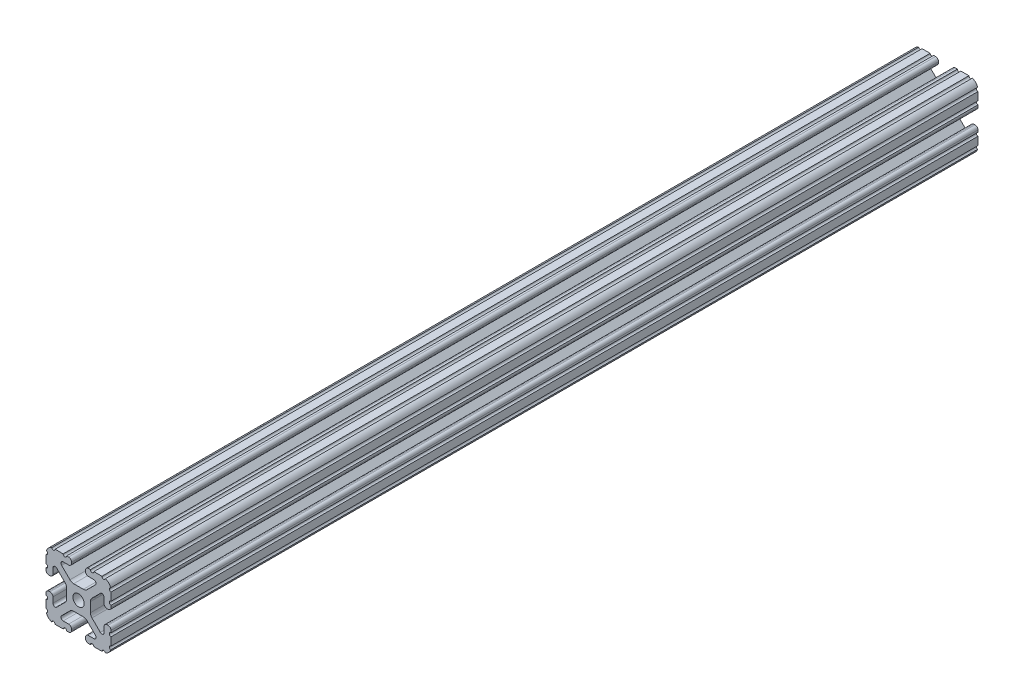
from build123d import *

# Parameters (mm, degrees)
BOSS_EXTRUDE1_DEPTH     = 304.8
CUT_EXTRUDE1_DEPTH      = 306.9883086
CUT_EXTRUDE1_DEPTH_BACK = 306.9883086
SKETCH5_R               = 1.016
CUT_EXTRUDE2_START      = -101.6
SKETCH6_R               = 3.3274
CUT_EXTRUDE2_DEPTH      = 101.6


with BuildPart() as part:
    # Sketch4 → Boss-Extrude1 (new, symmetric)
    with BuildSketch(Plane.XY):
        with BuildLine():
            Line((5.7912, -19.05), (14.3002, -19.05))
            ThreePointArc((14.3002, -19.05), (17.658815789, -17.658815789), (19.05, -14.3002))
            Line((19.05, -14.3002), (19.05, -5.7912))
            ThreePointArc((19.05, -5.7912), (18.544114832, -4.569885168), (17.3228, -4.064))
            Line((17.3228, -4.064), (16.7132, -4.064))
            ThreePointArc((16.7132, -4.064), (15.491885168, -4.569885168), (14.986, -5.7912))
            Line((14.986, -5.7912), (14.986, -8.996305235))
            ThreePointArc((14.986, -8.996305235), (14.189232738, -10.188751711), (12.782646215, -9.908964256))
            Line((12.782646215, -9.908964256), (7.888897763, -5.015215804))
            ThreePointArc((7.888897763, -5.015215804), (7.219915375, -4.014012907), (6.985, -2.833013566))
            Line((6.985, -2.833013566), (6.985, 0))
            Line((6.985, 0), (3.3274, 0))
            ThreePointArc((3.3274, 0), (2.352827104, -2.352827104), (0, -3.3274))
            Line((0, -3.3274), (0, -6.985))
            Line((0, -6.985), (2.833013566, -6.985))
            ThreePointArc((2.833013566, -6.985), (4.014012907, -7.219915375), (5.015215804, -7.888897763))
            Line((5.015215804, -7.888897763), (9.908964256, -12.782646215))
            ThreePointArc((9.908964256, -12.782646215), (10.188751711, -14.189232738), (8.996305235, -14.986))
            Line((8.996305235, -14.986), (5.7912, -14.986))
            ThreePointArc((5.7912, -14.986), (4.569885168, -15.491885168), (4.064, -16.7132))
            Line((4.064, -16.7132), (4.064, -17.3228))
            ThreePointArc((4.064, -17.3228), (4.569885168, -18.544114832), (5.7912, -19.05))
        make_face()
    extrude(amount=BOSS_EXTRUDE1_DEPTH, both=True)

    # Sketch5 → Cut-Extrude1 (cut, two sides: drawn at the far end of the back side and taken through both)
    with BuildSketch(Plane.XY.offset(-CUT_EXTRUDE1_DEPTH_BACK)):
        with Locations((14.739477062, -19.05)):
            Circle(SKETCH5_R)
        with Locations((7.980305235, -19.05)):
            Circle(SKETCH5_R)
        with Locations((19.05, -14.739477062)):
            Circle(SKETCH5_R)
        with Locations((19.05, -7.980305235)):
            Circle(SKETCH5_R)
    extrude(amount=CUT_EXTRUDE1_DEPTH + CUT_EXTRUDE1_DEPTH_BACK, mode=Mode.SUBTRACT)

    # Mirror1: part across plane


with BuildPart() as part_1:
    add(part.part)
    add(part.part.mirror(Plane(origin=(0, 0, 0), x_dir=(0, 0, 1), z_dir=(1, 0, 0))))

    # Mirror2: part across plane


with BuildPart() as part_2:
    add(part_1.part)
    add(part_1.part.mirror(Plane.ZX))

    # Sketch6 → Cut-Extrude2 (cut)
    with BuildSketch(Plane(origin=(0, 0, -304.8), x_dir=(-1, 0, 0), z_dir=(0, 0, -1)).offset(CUT_EXTRUDE2_START)):
        with BuildLine():
            Line((-19.05, -5.7912), (-19.05, -6.964305235))
            ThreePointArc((-19.05, -6.964305235), (-18.034, -7.980305235), (-19.05, -8.996305235))
            Line((-19.05, -8.996305235), (-19.05, -13.723477062))
            ThreePointArc((-19.05, -13.723477062), (-18.040083046, -14.628464695), (-18.829304583, -15.73121772))
            ThreePointArc((-18.829304583, -15.73121772), (-17.658815789, -17.658815789), (-15.73121772, -18.829304583))
            ThreePointArc((-15.73121772, -18.829304583), (-14.628464695, -18.040083046), (-13.723477062, -19.05))
            Line((-13.723477062, -19.05), (-8.996305235, -19.05))
            ThreePointArc((-8.996305235, -19.05), (-7.980305235, -18.034), (-6.964305235, -19.05))
            Line((-6.964305235, -19.05), (-5.7912, -19.05))
            ThreePointArc((-5.7912, -19.05), (-4.569885168, -18.544114832), (-4.064, -17.3228))
            Line((-4.064, -17.3228), (-4.064, -16.7132))
            ThreePointArc((-4.064, -16.7132), (-4.569885168, -15.491885168), (-5.7912, -14.986))
            Line((-5.7912, -14.986), (-8.996305235, -14.986))
            ThreePointArc((-8.996305235, -14.986), (-10.188751711, -14.189232738), (-9.908964256, -12.782646215))
            Line((-9.908964256, -12.782646215), (-5.015215804, -7.888897763))
            ThreePointArc((-5.015215804, -7.888897763), (-4.014012907, -7.219915375), (-2.833013566, -6.985))
            Line((-2.833013566, -6.985), (2.833013566, -6.985))
            ThreePointArc((2.833013566, -6.985), (4.014012907, -7.219915375), (5.015215804, -7.888897763))
            Line((5.015215804, -7.888897763), (9.908964256, -12.782646215))
            ThreePointArc((9.908964256, -12.782646215), (10.188751711, -14.189232738), (8.996305235, -14.986))
            Line((8.996305235, -14.986), (5.7912, -14.986))
            ThreePointArc((5.7912, -14.986), (4.569885168, -15.491885168), (4.064, -16.7132))
            Line((4.064, -16.7132), (4.064, -17.3228))
            ThreePointArc((4.064, -17.3228), (4.569885168, -18.544114832), (5.7912, -19.05))
            Line((5.7912, -19.05), (6.964305235, -19.05))
            ThreePointArc((6.964305235, -19.05), (7.980305235, -18.034), (8.996305235, -19.05))
            Line((8.996305235, -19.05), (13.723477062, -19.05))
            ThreePointArc((13.723477062, -19.05), (14.628464695, -18.040083046), (15.73121772, -18.829304583))
            ThreePointArc((15.73121772, -18.829304583), (17.658815789, -17.658815789), (18.829304583, -15.73121772))
            ThreePointArc((18.829304583, -15.73121772), (18.040083046, -14.628464695), (19.05, -13.723477062))
            Line((19.05, -13.723477062), (19.05, -8.996305235))
            ThreePointArc((19.05, -8.996305235), (18.034, -7.980305235), (19.05, -6.964305235))
            Line((19.05, -6.964305235), (19.05, -5.7912))
            ThreePointArc((19.05, -5.7912), (18.544114832, -4.569885168), (17.3228, -4.064))
            Line((17.3228, -4.064), (16.7132, -4.064))
            ThreePointArc((16.7132, -4.064), (15.491885168, -4.569885168), (14.986, -5.7912))
            Line((14.986, -5.7912), (14.986, -8.996305235))
            ThreePointArc((14.986, -8.996305235), (14.189232738, -10.188751711), (12.782646215, -9.908964256))
            Line((12.782646215, -9.908964256), (7.888897763, -5.015215804))
            ThreePointArc((7.888897763, -5.015215804), (7.219915375, -4.014012907), (6.985, -2.833013566))
            Line((6.985, -2.833013566), (6.985, 2.833013566))
            ThreePointArc((6.985, 2.833013566), (7.219915375, 4.014012907), (7.888897763, 5.015215804))
            Line((7.888897763, 5.015215804), (12.782646215, 9.908964256))
            ThreePointArc((12.782646215, 9.908964256), (14.189232738, 10.188751711), (14.986, 8.996305235))
            Line((14.986, 8.996305235), (14.986, 5.7912))
            ThreePointArc((14.986, 5.7912), (15.491885168, 4.569885168), (16.7132, 4.064))
            Line((16.7132, 4.064), (17.3228, 4.064))
            ThreePointArc((17.3228, 4.064), (18.544114832, 4.569885168), (19.05, 5.7912))
            Line((19.05, 5.7912), (19.05, 6.964305235))
            ThreePointArc((19.05, 6.964305235), (18.034, 7.980305235), (19.05, 8.996305235))
            Line((19.05, 8.996305235), (19.05, 13.723477062))
            ThreePointArc((19.05, 13.723477062), (18.040083046, 14.628464695), (18.829304583, 15.73121772))
            ThreePointArc((18.829304583, 15.73121772), (17.658815789, 17.658815789), (15.73121772, 18.829304583))
            ThreePointArc((15.73121772, 18.829304583), (14.628464695, 18.040083046), (13.723477062, 19.05))
            Line((13.723477062, 19.05), (8.996305235, 19.05))
            ThreePointArc((8.996305235, 19.05), (7.980305235, 18.034), (6.964305235, 19.05))
            Line((6.964305235, 19.05), (5.7912, 19.05))
            ThreePointArc((5.7912, 19.05), (4.569885168, 18.544114832), (4.064, 17.3228))
            Line((4.064, 17.3228), (4.064, 16.7132))
            ThreePointArc((4.064, 16.7132), (4.569885168, 15.491885168), (5.7912, 14.986))
            Line((5.7912, 14.986), (8.996305235, 14.986))
            ThreePointArc((8.996305235, 14.986), (10.188751711, 14.189232738), (9.908964256, 12.782646215))
            Line((9.908964256, 12.782646215), (5.015215804, 7.888897763))
            ThreePointArc((5.015215804, 7.888897763), (4.014012907, 7.219915375), (2.833013566, 6.985))
            Line((2.833013566, 6.985), (-2.833013566, 6.985))
            ThreePointArc((-2.833013566, 6.985), (-4.014012907, 7.219915375), (-5.015215804, 7.888897763))
            Line((-5.015215804, 7.888897763), (-9.908964256, 12.782646215))
            ThreePointArc((-9.908964256, 12.782646215), (-10.188751711, 14.189232738), (-8.996305235, 14.986))
            Line((-8.996305235, 14.986), (-5.7912, 14.986))
            ThreePointArc((-5.7912, 14.986), (-4.569885168, 15.491885168), (-4.064, 16.7132))
            Line((-4.064, 16.7132), (-4.064, 17.3228))
            ThreePointArc((-4.064, 17.3228), (-4.569885168, 18.544114832), (-5.7912, 19.05))
            Line((-5.7912, 19.05), (-6.964305235, 19.05))
            ThreePointArc((-6.964305235, 19.05), (-7.980305235, 18.034), (-8.996305235, 19.05))
            Line((-8.996305235, 19.05), (-13.723477062, 19.05))
            ThreePointArc((-13.723477062, 19.05), (-14.628464695, 18.040083046), (-15.73121772, 18.829304583))
            ThreePointArc((-15.73121772, 18.829304583), (-17.658815789, 17.658815789), (-18.829304583, 15.73121772))
            ThreePointArc((-18.829304583, 15.73121772), (-18.040083046, 14.628464695), (-19.05, 13.723477062))
            Line((-19.05, 13.723477062), (-19.05, 8.996305235))
            ThreePointArc((-19.05, 8.996305235), (-18.034, 7.980305235), (-19.05, 6.964305235))
            Line((-19.05, 6.964305235), (-19.05, 5.7912))
            ThreePointArc((-19.05, 5.7912), (-18.544114832, 4.569885168), (-17.3228, 4.064))
            Line((-17.3228, 4.064), (-16.7132, 4.064))
            ThreePointArc((-16.7132, 4.064), (-15.491885168, 4.569885168), (-14.986, 5.7912))
            Line((-14.986, 5.7912), (-14.986, 8.996305235))
            ThreePointArc((-14.986, 8.996305235), (-14.189232738, 10.188751711), (-12.782646215, 9.908964256))
            Line((-12.782646215, 9.908964256), (-7.888897763, 5.015215804))
            ThreePointArc((-7.888897763, 5.015215804), (-7.219915375, 4.014012907), (-6.985, 2.833013566))
            Line((-6.985, 2.833013566), (-6.985, -2.833013566))
            ThreePointArc((-6.985, -2.833013566), (-7.219915375, -4.014012907), (-7.888897763, -5.015215804))
            Line((-7.888897763, -5.015215804), (-12.782646215, -9.908964256))
            ThreePointArc((-12.782646215, -9.908964256), (-14.189232738, -10.188751711), (-14.986, -8.996305235))
            Line((-14.986, -8.996305235), (-14.986, -5.7912))
            ThreePointArc((-14.986, -5.7912), (-15.491885168, -4.569885168), (-16.7132, -4.064))
            Line((-16.7132, -4.064), (-17.3228, -4.064))
            ThreePointArc((-17.3228, -4.064), (-18.544114832, -4.569885168), (-19.05, -5.7912))
        make_face()
        Circle(SKETCH6_R, mode=Mode.SUBTRACT)
    extrude(amount=CUT_EXTRUDE2_DEPTH, mode=Mode.SUBTRACT)


solid = part_2.part
